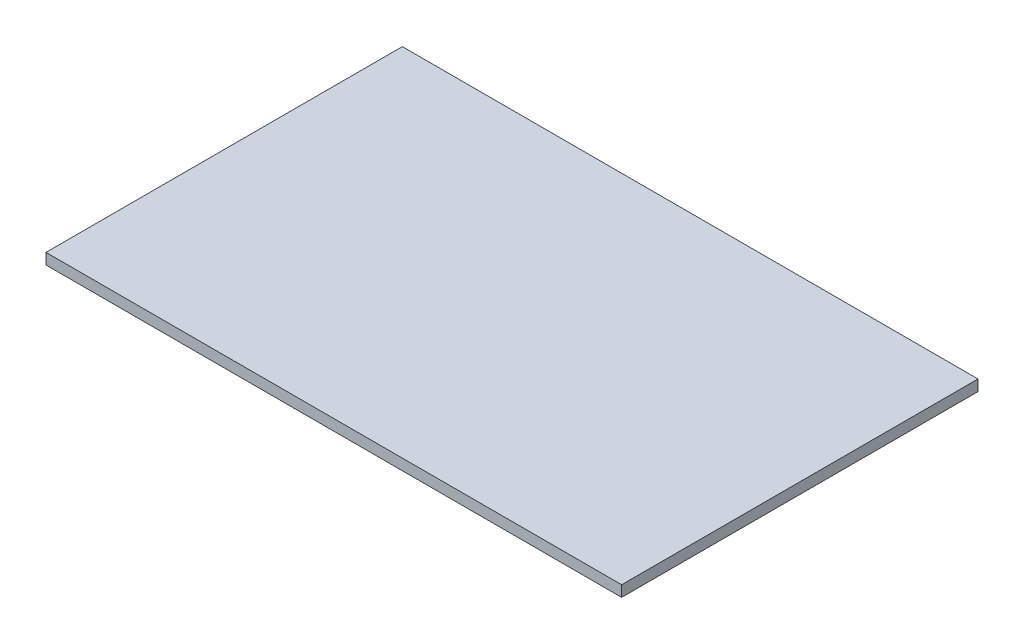
from build123d import *

# Parameters (mm, degrees)
SKIZZE3_W                       = 105
SKIZZE3_H                       = 65
AUFSATZ_LINEAR_AUSTRAGEN1_DEPTH = 2


with BuildPart() as part:
    # Skizze3 → Aufsatz-Linear austragen1 (new body)
    with BuildSketch(Plane(origin=(0, 0, 0), x_dir=(1, 0, 0), z_dir=(0, 1, 0))):
        with Locations((52.5, 32.5)):
            Rectangle(SKIZZE3_W, SKIZZE3_H)
    extrude(amount=AUFSATZ_LINEAR_AUSTRAGEN1_DEPTH)


solid = part.part
